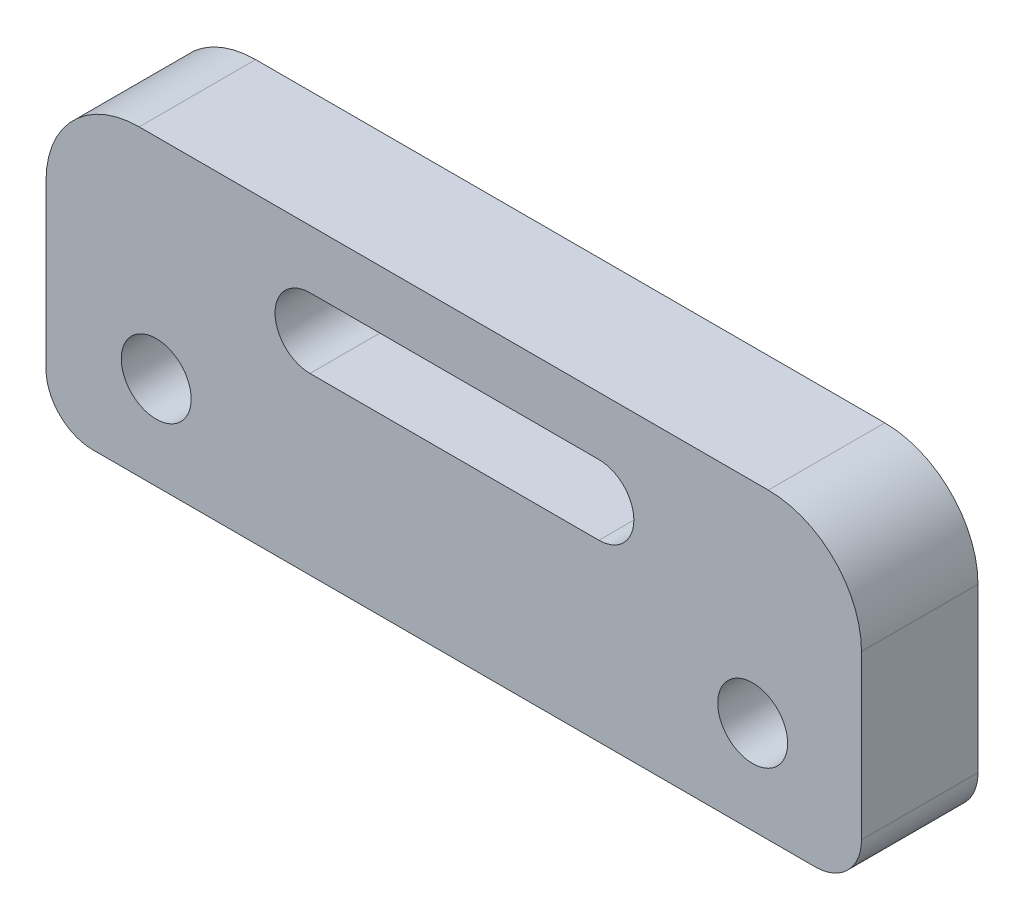
from build123d import *

# Parameters (mm, degrees)
ESQUISSE1_R        = 1.5
BOSS_EXTRU_1_DEPTH = 5


with BuildPart() as part:
    # Esquisse1 → Boss.-Extru.1 (new body)
    with BuildSketch(Plane.XY):
        with BuildLine():
            Line((18.252383146, -3.580169779), (18.252383146, 3.419830221))
            ThreePointArc((18.252383146, 3.419830221), (17.08081027, 6.248257345), (14.252383146, 7.419830221))
            Line((14.252383146, 7.419830221), (-12.747616854, 7.419830221))
            ThreePointArc((-12.747616854, 7.419830221), (-15.576043979, 6.248257345), (-16.747616854, 3.419830221))
            Line((-16.747616854, 3.419830221), (-16.747616854, -3.580169779))
            ThreePointArc((-16.747616854, -3.580169779), (-16.161830417, -4.994383342), (-14.747616854, -5.580169779))
            Line((-14.747616854, -5.580169779), (16.312383146, -5.580169779))
            ThreePointArc((16.312383146, -5.580169779), (17.687966708, -4.973585835), (18.252383146, -3.580169779))
        make_face()
        with Locations((13.582383146, -1.580169779)):
            Circle(ESQUISSE1_R, mode=Mode.SUBTRACT)
        with Locations((-12.017616854, -1.580169779)):
            Circle(ESQUISSE1_R, mode=Mode.SUBTRACT)
        with BuildLine():
            Line((-5.417616854, 1.919830221), (6.982383146, 1.919830221))
            ThreePointArc((6.982383146, 1.919830221), (8.482383146, 3.419830221), (6.982383146, 4.919830221))
            Line((6.982383146, 4.919830221), (-5.417616854, 4.919830221))
            ThreePointArc((-5.417616854, 4.919830221), (-6.917616854, 3.419830221), (-5.417616854, 1.919830221))
        make_face(mode=Mode.SUBTRACT)
    extrude(amount=BOSS_EXTRU_1_DEPTH)


solid = part.part
